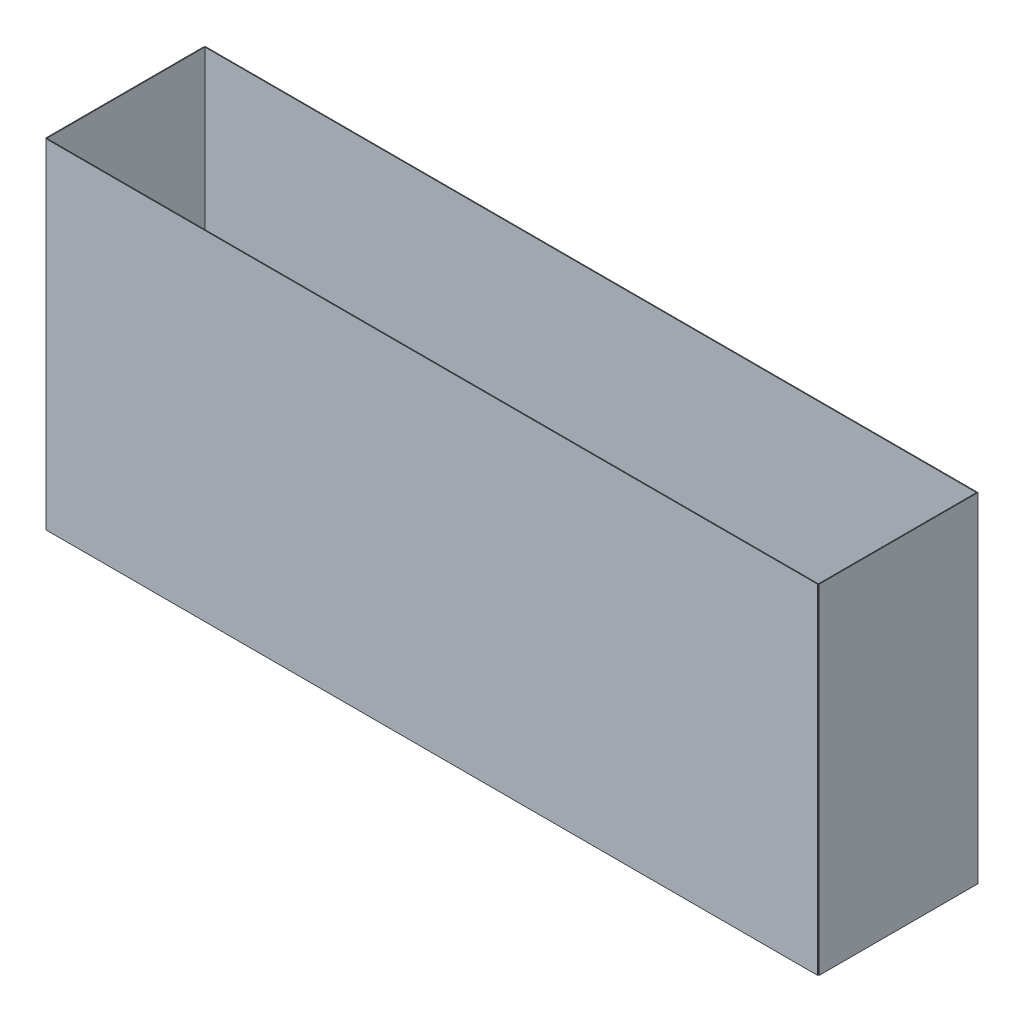
from build123d import *

# Parameters (mm, degrees)
CROQUIS1_W              = 102.500003815
CROQUIS1_H              = 45
SALIENTE_EXTRUIR1_DEPTH = 0.1
CROQUIS2_W              = 21.100000953
CROQUIS2_H              = 45
SALIENTE_EXTRUIR2_DEPTH = 0.1
CROQUIS3_W              = 102.500003815
CROQUIS3_H              = 45
SALIENTE_EXTRUIR3_DEPTH = 0.1
CROQUIS4_W              = 21.000000953
CROQUIS4_H              = 45
SALIENTE_EXTRUIR4_DEPTH = 0.1


with BuildPart() as part:
    # Croquis1 → Saliente-Extruir1 (new body)
    with BuildSketch(Plane(origin=(0, 0, -9.999999046), x_dir=(-1, 0, 0), z_dir=(0, 0, -1))):
        with Locations((1.753957749, -4.565101624)):
            Rectangle(CROQUIS1_W, CROQUIS1_H)
    extrude(amount=SALIENTE_EXTRUIR1_DEPTH)

    # Croquis2 → Saliente-Extruir2 (add)
    with BuildSketch(Plane(origin=(49.496044159, 0, 0), x_dir=(0, 0, -1), z_dir=(1, 0, 0))):
        with Locations((-0.450001431, -4.565101624)):
            Rectangle(CROQUIS2_W, CROQUIS2_H)
    extrude(amount=SALIENTE_EXTRUIR2_DEPTH)


with BuildPart() as body_2:
    # Croquis3 → Saliente-Extruir3 (new body)
    with BuildSketch(Plane.XY.offset(11.000001907)):
        with Locations((-1.753957749, -4.565101624)):
            Rectangle(CROQUIS3_W, CROQUIS3_H)
    extrude(amount=SALIENTE_EXTRUIR3_DEPTH)


with BuildPart() as body_3:
    # Croquis4 → Saliente-Extruir4 (new body)
    with BuildSketch(Plane.ZY.offset(53.003959656)):
        with Locations((0.500001431, -4.565101624)):
            Rectangle(CROQUIS4_W, CROQUIS4_H)
    extrude(amount=SALIENTE_EXTRUIR4_DEPTH)


solid = Compound([part.part, body_2.part, body_3.part])
